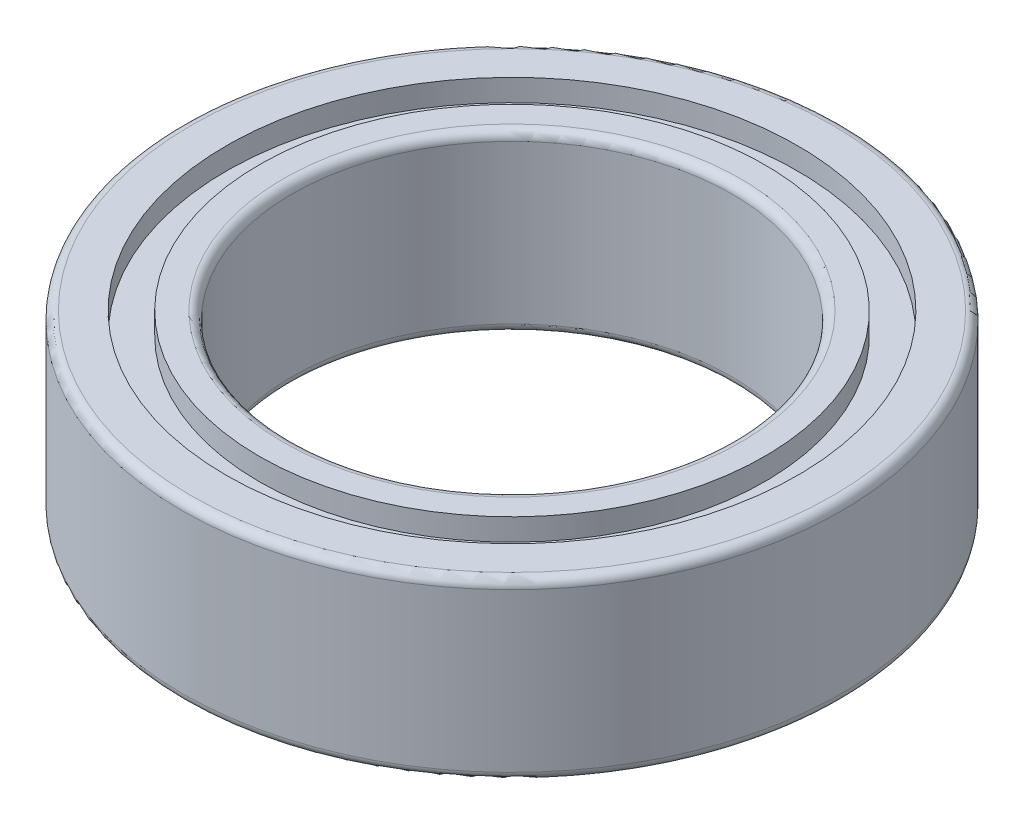
from build123d import *

# Parameters (mm, degrees)
BOSS_EXTRUDE1_DEPTH      = 2
BOSS_EXTRUDE1_DEPTH_BACK = 2
SKETCH1_R                = 7.5
SKETCH1_R_2              = 5
SKETCH2_R                = 6.5
SKETCH2_R_2              = 5.75
CUT_EXTRUDE1_DEPTH       = 0.5
FILLET1_R                = 0.2


with BuildPart() as part:
    # Sketch1 → Boss-Extrude1 (new, two sides: drawn at the far end of the back side and taken through both)
    with BuildSketch(Plane(origin=(0, 0, 0), x_dir=(1, 0, 0), z_dir=(0, 1, 0)).offset(-BOSS_EXTRUDE1_DEPTH_BACK)):
        Circle(SKETCH1_R)
        Circle(SKETCH1_R_2, mode=Mode.SUBTRACT)
    extrude(amount=BOSS_EXTRUDE1_DEPTH + BOSS_EXTRUDE1_DEPTH_BACK)

    # Sketch2 → Cut-Extrude1 (cut)
    with BuildSketch(Plane(origin=(0, 2, 0), x_dir=(1, 0, 0), z_dir=(0, 1, 0))):
        Circle(SKETCH2_R)
        Circle(SKETCH2_R_2, mode=Mode.SUBTRACT)
    cut_extrude1 = extrude(amount=-CUT_EXTRUDE1_DEPTH, mode=Mode.SUBTRACT)

    # Mirror2: Cut-Extrude1 across plane
    add(cut_extrude1.mirror(Plane.ZX), mode=Mode.SUBTRACT)

    # Fillet1
    fillet1_edges = [part.edges().sort_by_distance(p)[0] for p in [
        (-5, -2, 0),
        (-5, 2, 0),
        (-7.5, 2, 0),
        (-7.5, -2, 0),
    ]]
    fillet(fillet1_edges, radius=FILLET1_R)


solid = part.part
